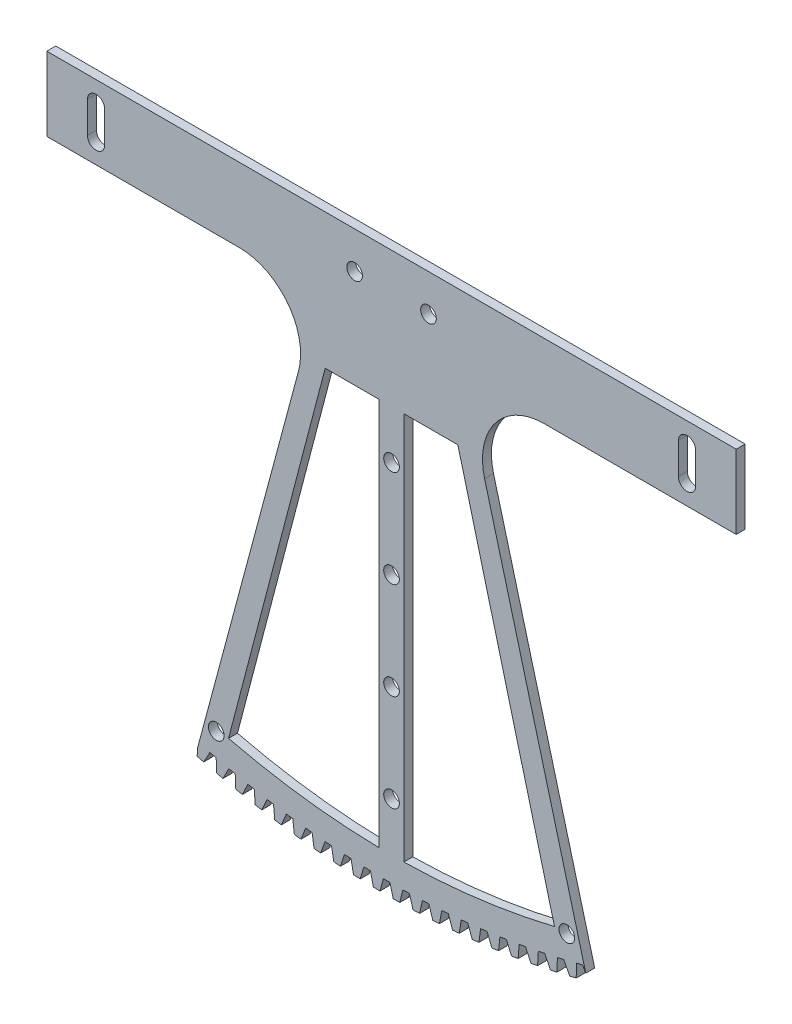
from build123d import *

# Parameters (mm, degrees)
BOSS_EXTRUDE2_DEPTH = 3.628571429
FILLET1_R           = 25
BOSS_EXTRUDE4_DEPTH = 3.628571429
CUT_EXTRUDE2_DEPTH  = 336.434355024
CIRPATTERN8_COUNT   = 20
CIRPATTERN8_ANGLE   = 28.5
SKETCH5_R           = 3.175
CUT_EXTRUDE3_DEPTH  = 338.743409804
SKETCH17_R          = 3.175
CUT_EXTRUDE4_DEPTH  = 338.743409804


with BuildPart() as part:
    # Sketch3 → Boss-Extrude2 (new body)
    with BuildSketch(Plane.XY):
        with BuildLine():
            Line((-140, -79.56), (-140, -109.56))
            Line((-140, -109.56), (-29.356513523, -109.56))
            Line((-29.356513523, -109.56), (-78.888044947, -294.414191853))
            ThreePointArc((-78.888044947, -294.414191853), (0, -304.8), (78.888044947, -294.414191853))
            Line((78.888044947, -294.414191853), (29.356513523, -109.56))
            Line((29.356513523, -109.56), (140, -109.56))
            Line((140, -109.56), (140, -79.56))
            Line((140, -79.56), (-140, -79.56))
        make_face()
    extrude(amount=BOSS_EXTRUDE2_DEPTH)

    # Fillet1
    fillet1_edges = [part.edges().sort_by_distance(p)[0] for p in [
        (29.356513523, -109.56, 1.814285714),
        (-29.356513523, -109.56, 1.814285714),
    ]]
    fillet(fillet1_edges, radius=FILLET1_R)

    # Sketch14 → Boss-Extrude4 (add)
    with BuildSketch(Plane(origin=(0, 0, 0), x_dir=(-1, 0, 0), z_dir=(0, 0, -1))):
        with BuildLine():
            Line((78.910933272, -297.036934084), (78.888044947, -294.414191853))
            ThreePointArc((78.888044947, -294.414191853), (76.959432674, -294.924203351), (75.027523715, -295.421581279))
            Line((75.027523715, -295.421581279), (76.289081309, -297.721097125))
            Line((76.289081309, -297.721097125), (78.910933272, -297.036934084))
        make_face()
    boss_extrude4 = extrude(amount=-BOSS_EXTRUDE4_DEPTH)

    # Sketch16 → Cut-Extrude2 (cut, symmetric)
    with BuildSketch(Plane(origin=(0, 0, 0), x_dir=(-1, 0, 0), z_dir=(0, 0, -1))):
        Polygon((372.937709596, -838.440145613), (75.027523715, -295.421581279), (73.765262731, -293.12078332), (71.19993834, -293.754449124), (71.154137831, -296.378353915), (60.344615656, -915.654378233), (357.400151379, -2118.250141136), (669.993245319, -2041.035908516), align=None)
    cut_extrude2 = extrude(amount=CUT_EXTRUDE2_DEPTH, both=True, mode=Mode.SUBTRACT)

    # CirPattern8: Boss-Extrude4, Cut-Extrude2 ×20 about axis
    cirpattern8_axis = Axis((0, 0, 0), (0, 0, 1))
    add([boss_extrude4.rotate(cirpattern8_axis, i * CIRPATTERN8_ANGLE / (CIRPATTERN8_COUNT - 1)) for i in range(1, CIRPATTERN8_COUNT)])
    add([cut_extrude2.rotate(cirpattern8_axis, i * CIRPATTERN8_ANGLE / (CIRPATTERN8_COUNT - 1)) for i in range(1, CIRPATTERN8_COUNT)], mode=Mode.SUBTRACT)

    # Sketch5 → Cut-Extrude3 (cut, through all)
    with BuildSketch(Plane(origin=(0, 0, 0), x_dir=(-1, 0, 0), z_dir=(0, 0, -1))):
        with Locations((-15, -94.56)):
            Circle(SKETCH5_R)
        with Locations((15, -94.56)):
            Circle(SKETCH5_R)
        with BuildLine():
            Line((-123.5, -94.56), (-123.5, -100.91))
            ThreePointArc((-123.5, -100.91), (-120, -104.41), (-116.5, -100.91))
            Line((-116.5, -100.91), (-116.5, -94.56))
            Line((-116.5, -94.56), (-116.5, -88.21))
            ThreePointArc((-116.5, -88.21), (-120, -84.71), (-123.5, -88.21))
            Line((-123.5, -88.21), (-123.5, -94.56))
        make_face()
        with BuildLine():
            Line((116.5, -94.56), (116.5, -88.21))
            ThreePointArc((116.5, -88.21), (120, -84.71), (123.5, -88.21))
            Line((123.5, -88.21), (123.5, -94.56))
            Line((123.5, -94.56), (123.5, -100.91))
            ThreePointArc((123.5, -100.91), (120, -104.41), (116.5, -100.91))
            Line((116.5, -100.91), (116.5, -94.56))
        make_face()
    extrude(amount=-CUT_EXTRUDE3_DEPTH, mode=Mode.SUBTRACT)

    # Sketch17 → Cut-Extrude4 (cut, through all)
    with BuildSketch(Plane(origin=(0, 0, 0), x_dir=(-1, 0, 0), z_dir=(0, 0, -1))):
        with BuildLine():
            Line((66.194365296, -284.361242536), (26.937147844, -134.56))
            Line((26.937147844, -134.56), (5, -134.56))
            Line((5, -134.56), (5, -292.259285824))
            ThreePointArc((5, -292.259285824), (35.815557854, -290.00224429), (66.194365296, -284.361242536))
        make_face()
        with BuildLine():
            ThreePointArc((-66.194365296, -284.361242536), (-35.815557854, -290.00224429), (-5, -292.259285824))
            Line((-5, -292.259285824), (-5, -134.56))
            Line((-5, -134.56), (-26.937147844, -134.56))
            Line((-26.937147844, -134.56), (-66.194365296, -284.361242536))
        make_face()
        with Locations((0, -272.546875096)):
            Circle(SKETCH17_R)
        with Locations((0, -233.12205364)):
            Circle(SKETCH17_R)
        with Locations((0, -193.697232184)):
            Circle(SKETCH17_R)
        with Locations((0, -154.272410728)):
            Circle(SKETCH17_R)
        with Locations((-71.194365296, -284.361242536)):
            Circle(SKETCH17_R)
        with Locations((71.194365296, -284.361242536)):
            Circle(SKETCH17_R)
    extrude(amount=-CUT_EXTRUDE4_DEPTH, mode=Mode.SUBTRACT)


solid = part.part
